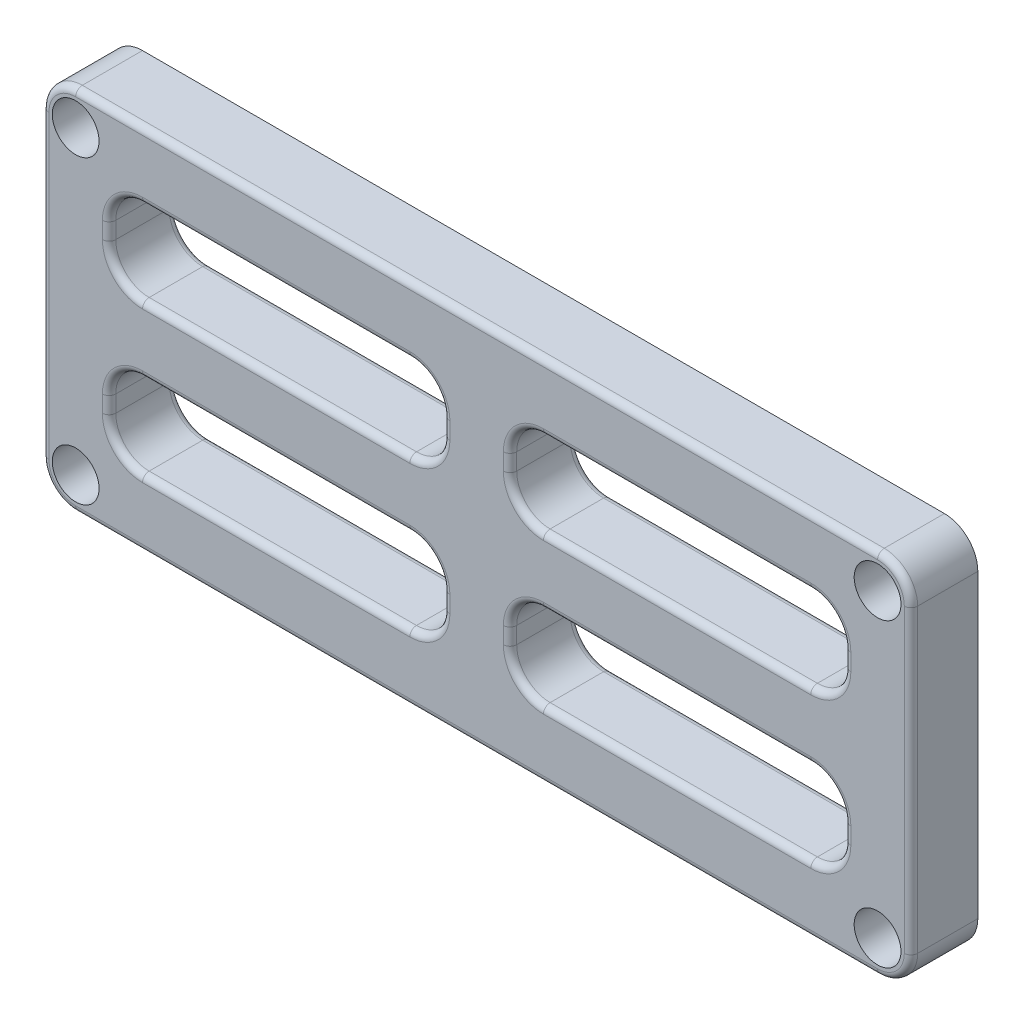
from build123d import *

# Parameters (mm, degrees)
SKETCH1_W           = 65
SKETCH1_H           = 27.5
SKETCH1_W_2         = 55
SKETCH1_H_2         = 17.5
BOSS_EXTRUDE1_DEPTH = 5
BOSS_EXTRUDE2_DEPTH = 5
SKETCH3_R           = 1.75
CUT_EXTRUDE1_DEPTH  = 71.75485849
FILLET1_R           = 2.5
FILLET2_R           = 0.5


with BuildPart() as part:
    # Sketch1 → Boss-Extrude1 (new body)
    with BuildSketch(Plane.XY):
        with Locations((32.5, 13.75)):
            Rectangle(SKETCH1_W, SKETCH1_H)
        with Locations((32.5, 13.75)):
            Rectangle(SKETCH1_W_2, SKETCH1_H_2, mode=Mode.SUBTRACT)
    extrude(amount=BOSS_EXTRUDE1_DEPTH)

    # Sketch2 → Boss-Extrude2 (add)
    with BuildSketch(Plane.XY.offset(5)):
        Polygon((5, 13.75), (5, 16.25), (30, 16.25), (30, 22.5), (32.5, 22.5), (35, 22.5), (35, 16.25), (60, 16.25), (60, 13.75), (60, 11.25), (35, 11.25), (35, 5), (32.5, 5), (30, 5), (30, 11.25), (5, 11.25), align=None)
    extrude(amount=-BOSS_EXTRUDE2_DEPTH)

    # Sketch3 → Cut-Extrude1 (cut, through all)
    with BuildSketch(Plane.XY.offset(5)):
        with Locations((2.5, 2.5)):
            Circle(SKETCH3_R)
        with Locations((62.5, 2.5)):
            Circle(SKETCH3_R)
        with Locations((62.5, 25)):
            Circle(SKETCH3_R)
        with Locations((2.5, 25)):
            Circle(SKETCH3_R)
    extrude(amount=-CUT_EXTRUDE1_DEPTH, mode=Mode.SUBTRACT)

    # Fillet1
    fillet1_edges = [part.edges().sort_by_distance(p)[0] for p in [
        (60, 22.5, 2.5),
        (5, 22.5, 2.5),
        (5, 5, 2.5),
        (60, 5, 2.5),
        (5, 11.25, 2.5),
        (5, 16.25, 2.5),
        (30, 16.25, 2.5),
        (30, 22.5, 2.5),
        (35, 22.5, 2.5),
        (35, 16.25, 2.5),
        (60, 16.25, 2.5),
        (60, 11.25, 2.5),
        (35, 11.25, 2.5),
        (35, 5, 2.5),
        (30, 5, 2.5),
        (30, 11.25, 2.5),
        (0, 27.5, 2.5),
        (65, 27.5, 2.5),
        (65, 0, 2.5),
        (0, 0, 2.5),
    ]]
    fillet(fillet1_edges, radius=FILLET1_R)

    # Fillet2
    fillet2_edges = [part.edges().sort_by_distance(p)[0] for p in [
        (5, 8.125, 5),
        (5, 8.125, 0),
        (17.5, 5, 0),
        (17.5, 5, 5),
        (17.5, 11.25, 5),
        (17.5, 11.25, 0),
        (17.5, 16.25, 5),
        (17.5, 16.25, 0),
        (5, 19.375, 0),
        (5, 19.375, 5),
        (17.5, 22.5, 5),
        (17.5, 22.5, 0),
        (30, 8.125, 5),
        (30, 8.125, 0),
        (30, 19.375, 5),
        (30, 19.375, 0),
        (47.5, 11.25, 5),
        (47.5, 11.25, 0),
        (60, 8.125, 0),
        (60, 8.125, 5),
        (35, 8.125, 5),
        (35, 8.125, 0),
        (47.5, 5, 5),
        (47.5, 5, 0),
        (60, 19.375, 5),
        (60, 19.375, 0),
        (47.5, 16.25, 5),
        (47.5, 16.25, 0),
        (35, 19.375, 5),
        (35, 19.375, 0),
        (47.5, 22.5, 0),
        (47.5, 22.5, 5),
        (32.5, 27.5, 5),
        (65, 13.75, 5),
        (0, 13.75, 5),
        (32.5, 0, 5),
        (0.732233047, 0.732233047, 5),
        (0.732233047, 26.767766953, 5),
        (64.267766953, 0.732233047, 5),
        (64.267766953, 26.767766953, 5),
        (5.732233047, 5.732233047, 0),
        (5.732233047, 5.732233047, 5),
        (5.732233047, 10.517766953, 5),
        (5.732233047, 10.517766953, 0),
        (5.732233047, 16.982233047, 5),
        (5.732233047, 16.982233047, 0),
        (5.732233047, 21.767766953, 0),
        (5.732233047, 21.767766953, 5),
        (29.267766953, 5.732233047, 5),
        (29.267766953, 5.732233047, 0),
        (29.267766953, 16.982233047, 5),
        (29.267766953, 16.982233047, 0),
        (29.267766953, 10.517766953, 5),
        (29.267766953, 10.517766953, 0),
        (29.267766953, 21.767766953, 5),
        (29.267766953, 21.767766953, 0),
        (59.267766953, 10.517766953, 5),
        (59.267766953, 10.517766953, 0),
        (35.732233047, 10.517766953, 5),
        (35.732233047, 10.517766953, 0),
        (35.732233047, 5.732233047, 5),
        (35.732233047, 5.732233047, 0),
        (59.267766953, 5.732233047, 0),
        (59.267766953, 5.732233047, 5),
        (59.267766953, 16.982233047, 5),
        (59.267766953, 16.982233047, 0),
        (35.732233047, 16.982233047, 5),
        (35.732233047, 16.982233047, 0),
        (35.732233047, 21.767766953, 5),
        (35.732233047, 21.767766953, 0),
        (59.267766953, 21.767766953, 0),
        (59.267766953, 21.767766953, 5),
    ]]
    fillet(fillet2_edges, radius=FILLET2_R)


solid = part.part
